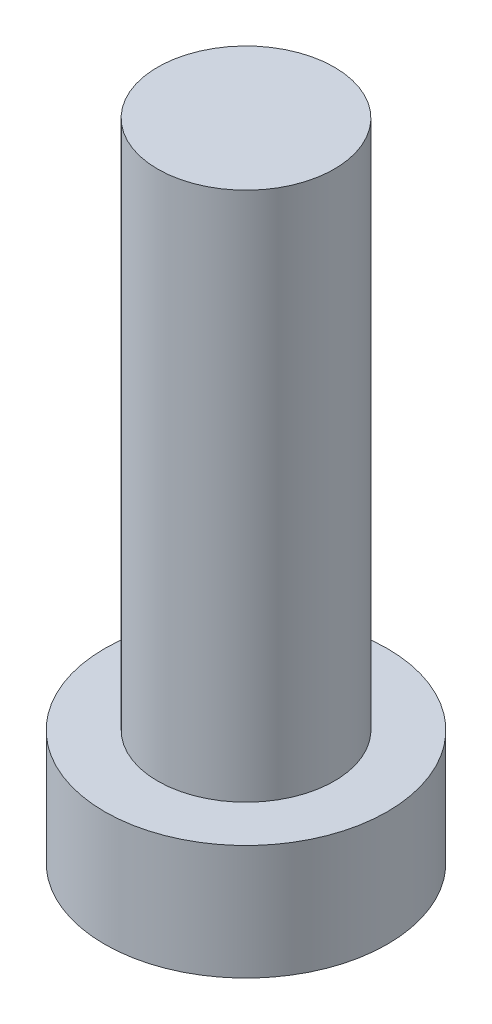
from build123d import *

# Parameters (mm, degrees)
SKETCH_1_R      = 1.6
EXTRUDE_1_DEPTH = 1.3
EXTRUDE_START   = 1.3
SKETCH_2_R      = 1
EXTRUDE_2_DEPTH = 6


with BuildPart() as part:
    # 草图1 → 凸台-拉伸1 (new body)
    with BuildSketch(Plane(origin=(0, 0, 0), x_dir=(1, 0, 0), z_dir=(0, 1, 0))):
        with Locations(Location((0, 0, 0), (0, 0, 270))):
            Circle(SKETCH_1_R)
    extrude(amount=EXTRUDE_1_DEPTH)

    # 草图2 → 凸台-拉伸2 (add)
    with BuildSketch(Plane(origin=(0, 0, 0), x_dir=(1, 0, 0), z_dir=(0, 1, 0)).offset(EXTRUDE_START)):
        with Locations(Location((0, 0, 0), (0, 0, 270))):
            Circle(SKETCH_2_R)
    extrude(amount=EXTRUDE_2_DEPTH)


solid = part.part
